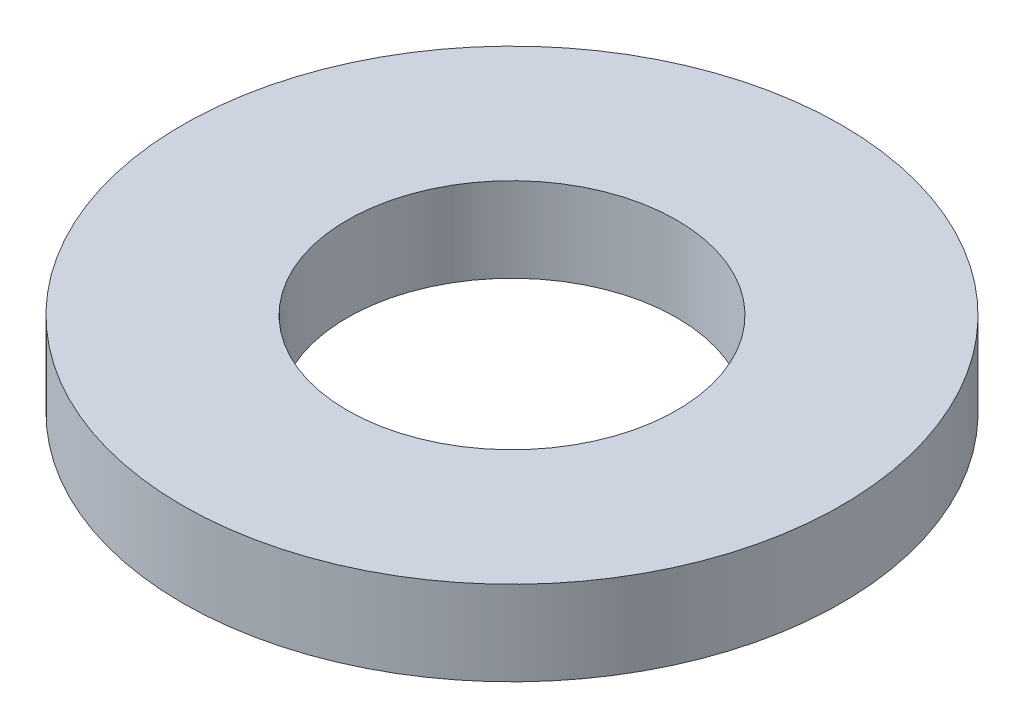
from build123d import *

# Parameters (mm, degrees)
SKETCH1_R           = 3.9624
BOSS_EXTRUDE1_DEPTH = 1.016
SKETCH5_R           = 1.9812
CUT_EXTRUDE1_DEPTH  = 6.695040256


with BuildPart() as part:
    # Sketch1 → Boss-Extrude1 (new body)
    with BuildSketch(Plane(origin=(0, 0, 0), x_dir=(1, 0, 0), z_dir=(0, 1, 0))):
        with Locations(Location((0, 0, 0), (0, 0, 270))):
            Circle(SKETCH1_R)
    extrude(amount=BOSS_EXTRUDE1_DEPTH)

    # Sketch5 → Cut-Extrude1 (cut, through all)
    with BuildSketch(Plane(origin=(0, 1.016, 0), x_dir=(-1, 0, 0), z_dir=(0, 1, 0))):
        with Locations(Location((0, 0, 0), (0, 0, 90))):
            Circle(SKETCH5_R)
    extrude(amount=-CUT_EXTRUDE1_DEPTH, mode=Mode.SUBTRACT)


solid = part.part
